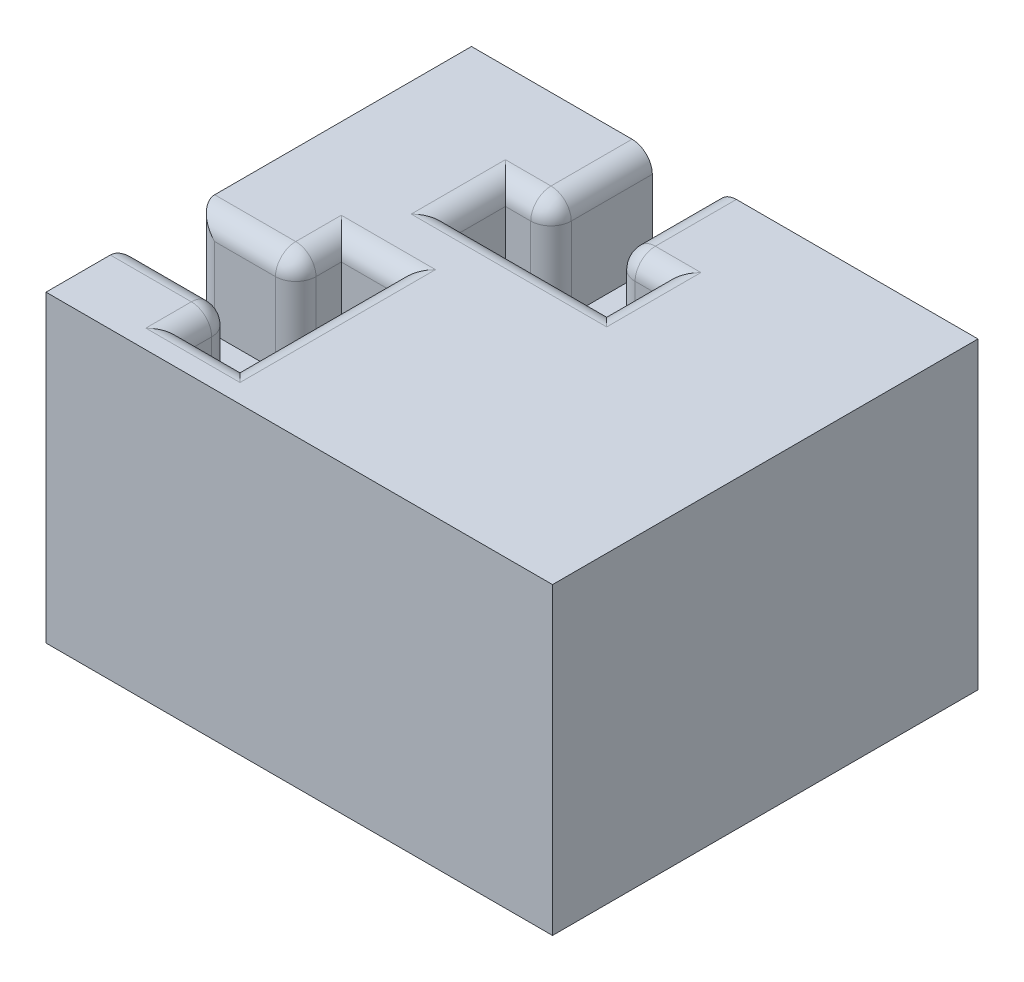
from build123d import *

# Parameters (mm, degrees)
SKETCH1_W           = 25
SKETCH1_H           = 21
BOSS_EXTRUDE1_DEPTH = 15
SKETCH2_W           = 15
SKETCH2_H           = 3.4
CUT_EXTRUDE1_DEPTH  = 22.6
CUT_EXTRUDE2_DEPTH  = 5
FILLET1_R           = 1


with BuildPart() as part:
    # Sketch1 → Boss-Extrude1 (new body)
    with BuildSketch(Plane(origin=(0, 0, 0), x_dir=(1, 0, 0), z_dir=(0, 1, 0))):
        Rectangle(SKETCH1_W, SKETCH1_H)
    extrude(amount=BOSS_EXTRUDE1_DEPTH)

    # Sketch2 → Cut-Extrude1 (cut)
    with BuildSketch(Plane.ZY.offset(12.5)):
        with Locations((-3, 3.7)):
            Rectangle(SKETCH2_W, SKETCH2_H)
    extrude(amount=-CUT_EXTRUDE1_DEPTH, mode=Mode.SUBTRACT)

    # Sketch3 → Cut-Extrude2 (cut)
    with BuildSketch(Plane(origin=(0, 15, 0), x_dir=(1, 0, 0), z_dir=(0, 1, 0))):
        Polygon((-4.85, -0.925), (-4.85, -8.575), (-7.5, -8.575), (-7.5, -6.325), (-12.5, -6.325), (-12.5, -3.175), (-7.5, -3.175), (-7.5, -0.925), align=None)
        Polygon((-3.575, 10.5), (-0.425, 10.5), (-0.425, 5.5), (1.825, 5.5), (1.825, 2.85), (-5.825, 2.85), (-5.825, 5.5), (-3.575, 5.5), align=None)
    extrude(amount=-CUT_EXTRUDE2_DEPTH, mode=Mode.SUBTRACT)

    # Fillet1
    fillet1_edges = [part.edges().sort_by_distance(p)[0] for p in [
        (-7.5, 12.5, 6.325),
        (-12.5, 12.5, 6.325),
        (-12.5, 12.5, 3.175),
        (-7.5, 12.5, 3.175),
        (-6.175, 15, 0.925),
        (-7.5, 15, 2.05),
        (-10, 15, 3.175),
        (-10, 15, 6.325),
        (-7.5, 15, 7.45),
        (-6.175, 15, 8.575),
        (-4.85, 15, 4.75),
        (-3.575, 12.5, -5.5),
        (-0.425, 12.5, -5.5),
        (-3.575, 15, -8),
        (-4.7, 15, -5.5),
        (-5.825, 15, -4.175),
        (-2, 15, -2.85),
        (1.825, 15, -4.175),
        (0.7, 15, -5.5),
        (-0.425, 15, -8),
    ]]
    fillet(fillet1_edges, radius=FILLET1_R)


solid = part.part
